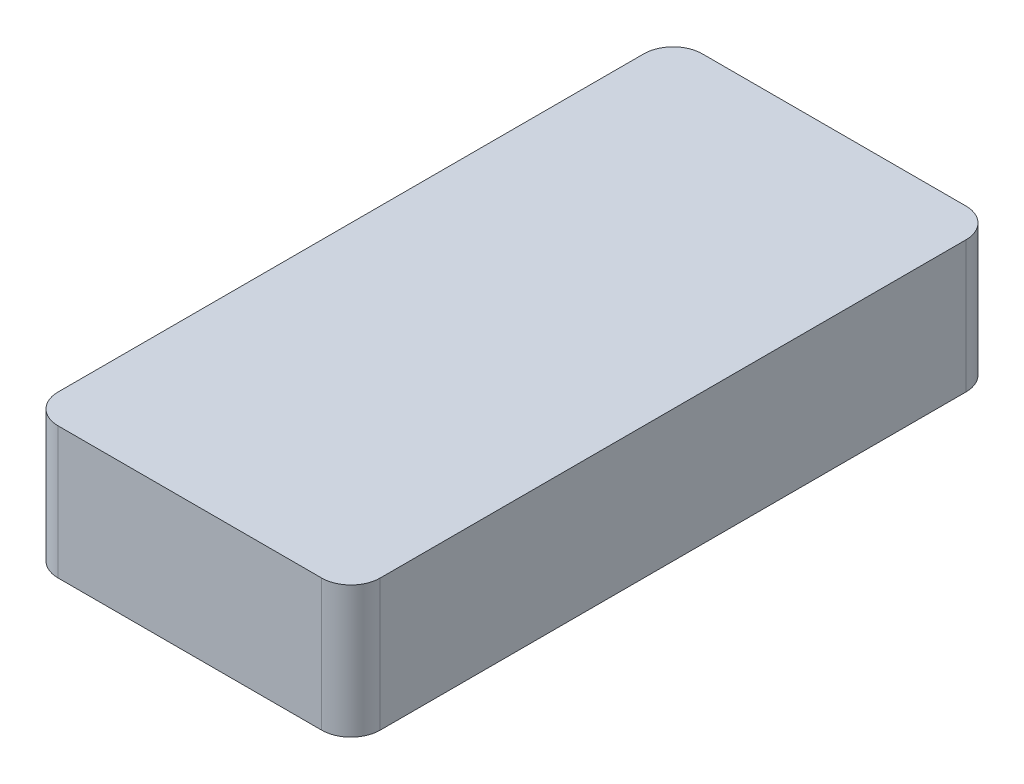
from build123d import *

# Parameters (mm, degrees)
SKETCH1_W           = 22
SKETCH1_H           = 44
BOSS_EXTRUDE1_DEPTH = 9
FILLET1_R           = 2


with BuildPart() as part:
    # Sketch1 → Boss-Extrude1 (new body)
    with BuildSketch(Plane(origin=(0, 0, 0), x_dir=(1, 0, 0), z_dir=(0, 1, 0))):
        Rectangle(SKETCH1_W, SKETCH1_H)
    extrude(amount=BOSS_EXTRUDE1_DEPTH)

    # Fillet1
    fillet1_edges = [part.edges().sort_by_distance(p)[0] for p in [
        (11, 4.5, 22),
        (-11, 4.5, 22),
        (-11, 4.5, -22),
        (11, 4.5, -22),
    ]]
    fillet(fillet1_edges, radius=FILLET1_R)


solid = part.part
